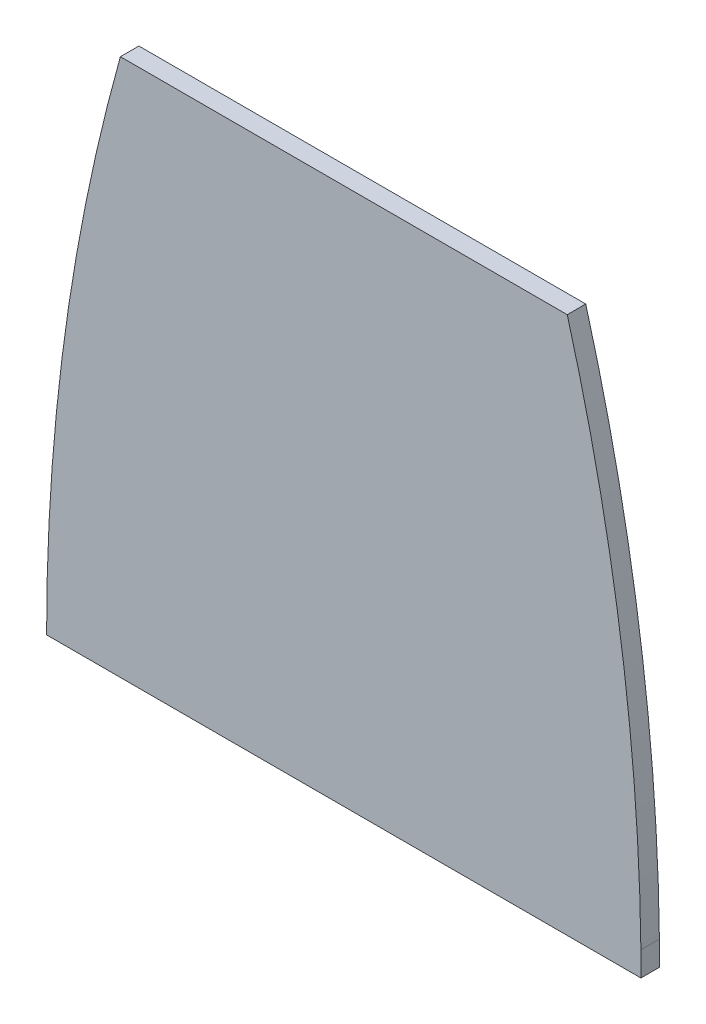
from build123d import *

# Parameters (mm, degrees)
EXTRUDE_1_DEPTH = 3


with BuildPart() as part:
    # Эскиз1 → Бобышка-Вытянуть1 (new body)
    with BuildSketch(Plane.XY):
        with BuildLine():
            Line((-48.187864079, -43.592778028), (48.187864079, -43.592778028))
            Line((48.187864079, -43.592778028), (48.187864079, -39.62953127))
            ThreePointArc((48.187864079, -39.62953127), (44.93098729, 2.371145135), (36.245306749, 43.592778028))
            Line((36.245306749, 43.592778028), (-36.221034906, 43.592778028))
            ThreePointArc((-36.221034906, 43.592778028), (-45.182197414, 0.408716791), (-48.187864079, -43.592778028))
        make_face()
    extrude(amount=EXTRUDE_1_DEPTH)


solid = part.part
